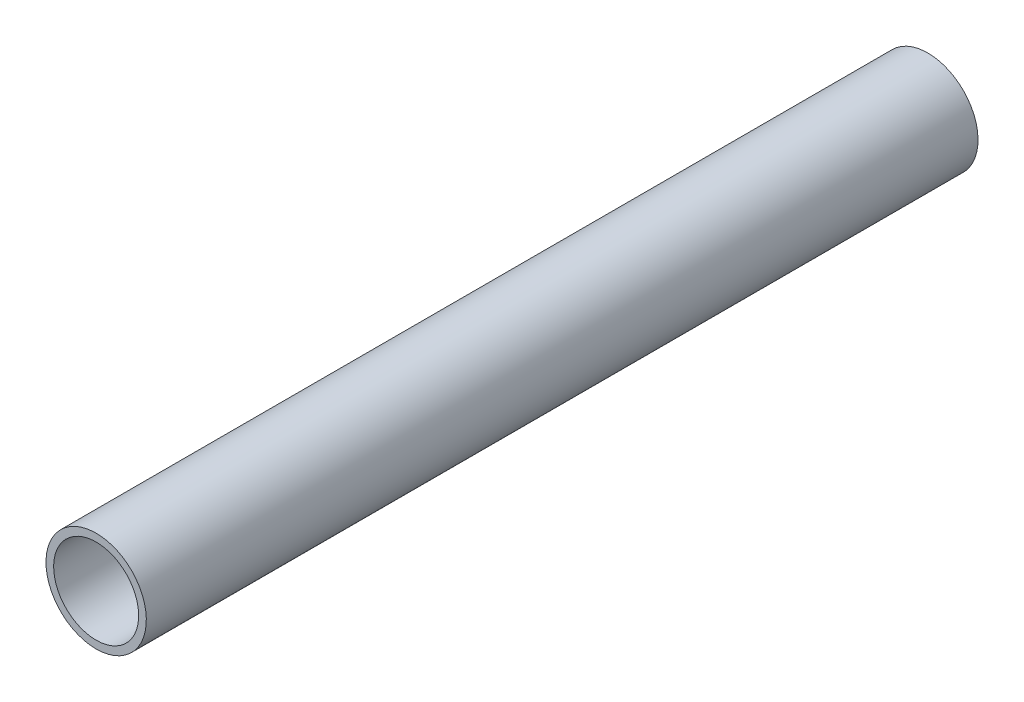
from build123d import *


with BuildPart() as part:
    # Croquis2 → Revolución1 (revolve)
    with BuildSketch(Plane(origin=(0, 0, 0), x_dir=(0, 0, -1), z_dir=(1, 0, 0)), mode=Mode.PRIVATE) as revoluci_n1_sk:
        Polygon((-200, 24.13), (-200, 20.447), (50, 20.447), (200, 20.447), (200, 24.13), align=None)
    revolve(revoluci_n1_sk.sketch.rotate(Axis((0, 0, 200), (0, 0, -1)), 180), axis=Axis((0, 0, 200), (0, 0, -1)))


solid = part.part
